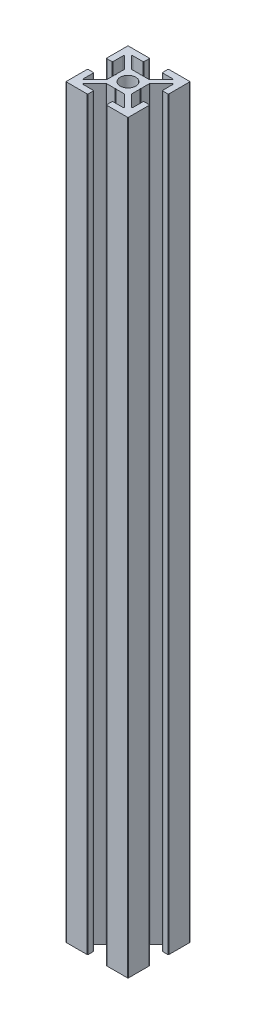
from build123d import *

# Parameters (mm, degrees)
SKETCH1_R           = 2.5
BOSS_EXTRUDE1_DEPTH = 240


with BuildPart() as part:
    # Sketch1 → Boss-Extrude1 (new body)
    with BuildSketch(Plane(origin=(0, 0, 0), x_dir=(1, 0, 0), z_dir=(0, 1, 0))):
        with BuildLine():
            Line((-2.997918472, 4.058578644), (-6.597918472, 7.658578644))
            ThreePointArc((-6.597918472, 7.658578644), (-6.621415508, 7.686854412), (-6.639339828, 7.718953455))
            ThreePointArc((-6.639339828, 7.718953455), (-6.656497116, 7.8), (-6.639339828, 7.881046545))
            ThreePointArc((-6.639339828, 7.881046545), (-6.565562901, 7.967644429), (-6.456497116, 8))
            Line((-6.456497116, 8), (-3.2, 8))
            ThreePointArc((-3.2, 8), (-3.058578644, 8.058578644), (-3, 8.2))
            Line((-3, 8.2), (-3, 9.8))
            ThreePointArc((-3, 9.8), (-3.058578644, 9.941421356), (-3.2, 10))
            Line((-3.2, 10), (-9.8, 10))
            ThreePointArc((-9.8, 10), (-9.941421356, 9.941421356), (-10, 9.8))
            Line((-10, 9.8), (-10, 3.2))
            ThreePointArc((-10, 3.2), (-9.941421356, 3.058578644), (-9.8, 3))
            Line((-9.8, 3), (-8.2, 3))
            ThreePointArc((-8.2, 3), (-8.058578644, 3.058578644), (-8, 3.2))
            Line((-8, 3.2), (-8, 6.456497116))
            ThreePointArc((-8, 6.456497116), (-7.967644429, 6.565562901), (-7.881046545, 6.639339828))
            ThreePointArc((-7.881046545, 6.639339828), (-7.8, 6.656497116), (-7.718953455, 6.639339828))
            ThreePointArc((-7.718953455, 6.639339828), (-7.686854412, 6.621415508), (-7.658578644, 6.597918472))
            Line((-7.658578644, 6.597918472), (-4.058578644, 2.997918472))
            ThreePointArc((-4.058578644, 2.997918472), (-4.015224093, 2.933033802), (-4, 2.856497116))
            Line((-4, 2.856497116), (-4, 0.130901699))
            ThreePointArc((-4, 0.130901699), (-3.99253254, 0.104615144), (-3.97236068, 0.08618034))
            Line((-3.97236068, 0.08618034), (-3.8, 0))
            Line((-3.8, 0), (-3.97236068, -0.08618034))
            ThreePointArc((-3.97236068, -0.08618034), (-3.99253254, -0.104615144), (-4, -0.130901699))
            Line((-4, -0.130901699), (-4, -2.856497116))
            ThreePointArc((-4, -2.856497116), (-4.015224093, -2.933033802), (-4.058578644, -2.997918472))
            Line((-4.058578644, -2.997918472), (-7.658578644, -6.597918472))
            ThreePointArc((-7.658578644, -6.597918472), (-7.686854412, -6.621415508), (-7.718953455, -6.639339828))
            ThreePointArc((-7.718953455, -6.639339828), (-7.8, -6.656497116), (-7.881046545, -6.639339828))
            ThreePointArc((-7.881046545, -6.639339828), (-7.967644429, -6.565562901), (-8, -6.456497116))
            Line((-8, -6.456497116), (-8, -3.2))
            ThreePointArc((-8, -3.2), (-8.058578644, -3.058578644), (-8.2, -3))
            Line((-8.2, -3), (-9.8, -3))
            ThreePointArc((-9.8, -3), (-9.941421356, -3.058578644), (-10, -3.2))
            Line((-10, -3.2), (-10, -9.8))
            ThreePointArc((-10, -9.8), (-9.941421356, -9.941421356), (-9.8, -10))
            Line((-9.8, -10), (-3.2, -10))
            ThreePointArc((-3.2, -10), (-3.058578644, -9.941421356), (-3, -9.8))
            Line((-3, -9.8), (-3, -8.2))
            ThreePointArc((-3, -8.2), (-3.058578644, -8.058578644), (-3.2, -8))
            Line((-3.2, -8), (-6.456497116, -8))
            ThreePointArc((-6.456497116, -8), (-6.565562901, -7.967644429), (-6.639339828, -7.881046545))
            ThreePointArc((-6.639339828, -7.881046545), (-6.656497116, -7.8), (-6.639339828, -7.718953455))
            ThreePointArc((-6.639339828, -7.718953455), (-6.621415508, -7.686854412), (-6.597918472, -7.658578644))
            Line((-6.597918472, -7.658578644), (-2.997918472, -4.058578644))
            ThreePointArc((-2.997918472, -4.058578644), (-2.933033802, -4.015224093), (-2.856497116, -4))
            Line((-2.856497116, -4), (-0.211803399, -4))
            ThreePointArc((-0.211803399, -4), (-0.200315753, -3.998662449), (-0.189442719, -3.99472136))
            Line((-0.189442719, -3.99472136), (0, -3.9))
            Line((0, -3.9), (0.189442719, -3.99472136))
            ThreePointArc((0.189442719, -3.99472136), (0.200315753, -3.998662449), (0.211803399, -4))
            Line((0.211803399, -4), (2.856497116, -4))
            ThreePointArc((2.856497116, -4), (2.933033802, -4.015224093), (2.997918472, -4.058578644))
            Line((2.997918472, -4.058578644), (6.597918472, -7.658578644))
            ThreePointArc((6.597918472, -7.658578644), (6.621415508, -7.686854412), (6.639339828, -7.718953455))
            ThreePointArc((6.639339828, -7.718953455), (6.656497116, -7.8), (6.639339828, -7.881046545))
            ThreePointArc((6.639339828, -7.881046545), (6.565562901, -7.967644429), (6.456497116, -8))
            Line((6.456497116, -8), (3.2, -8))
            ThreePointArc((3.2, -8), (3.058578644, -8.058578644), (3, -8.2))
            Line((3, -8.2), (3, -9.8))
            ThreePointArc((3, -9.8), (3.058578644, -9.941421356), (3.2, -10))
            Line((3.2, -10), (9.8, -10))
            ThreePointArc((9.8, -10), (9.941421356, -9.941421356), (10, -9.8))
            Line((10, -9.8), (10, -3.2))
            ThreePointArc((10, -3.2), (9.941421356, -3.058578644), (9.8, -3))
            Line((9.8, -3), (8.2, -3))
            ThreePointArc((8.2, -3), (8.058578644, -3.058578644), (8, -3.2))
            Line((8, -3.2), (8, -6.456497116))
            ThreePointArc((8, -6.456497116), (7.967644429, -6.565562901), (7.881046545, -6.639339828))
            ThreePointArc((7.881046545, -6.639339828), (7.8, -6.656497116), (7.718953455, -6.639339828))
            ThreePointArc((7.718953455, -6.639339828), (7.686854412, -6.621415508), (7.658578644, -6.597918472))
            Line((7.658578644, -6.597918472), (4.058578644, -2.997918472))
            ThreePointArc((4.058578644, -2.997918472), (4.015224093, -2.933033802), (4, -2.856497116))
            Line((4, -2.856497116), (4, -0.130901699))
            ThreePointArc((4, -0.130901699), (3.99253254, -0.104615144), (3.97236068, -0.08618034))
            Line((3.97236068, -0.08618034), (3.8, 0))
            Line((3.8, 0), (3.97236068, 0.08618034))
            ThreePointArc((3.97236068, 0.08618034), (3.99253254, 0.104615144), (4, 0.130901699))
            Line((4, 0.130901699), (4, 2.856497116))
            ThreePointArc((4, 2.856497116), (4.015224093, 2.933033802), (4.058578644, 2.997918472))
            Line((4.058578644, 2.997918472), (7.658578644, 6.597918472))
            ThreePointArc((7.658578644, 6.597918472), (7.686854412, 6.621415508), (7.718953455, 6.639339828))
            ThreePointArc((7.718953455, 6.639339828), (7.8, 6.656497116), (7.881046545, 6.639339828))
            ThreePointArc((7.881046545, 6.639339828), (7.967644429, 6.565562901), (8, 6.456497116))
            Line((8, 6.456497116), (8, 3.2))
            ThreePointArc((8, 3.2), (8.058578644, 3.058578644), (8.2, 3))
            Line((8.2, 3), (9.8, 3))
            ThreePointArc((9.8, 3), (9.941421356, 3.058578644), (10, 3.2))
            Line((10, 3.2), (10, 9.8))
            ThreePointArc((10, 9.8), (9.941421356, 9.941421356), (9.8, 10))
            Line((9.8, 10), (3.2, 10))
            ThreePointArc((3.2, 10), (3.058578644, 9.941421356), (3, 9.8))
            Line((3, 9.8), (3, 8.2))
            ThreePointArc((3, 8.2), (3.058578644, 8.058578644), (3.2, 8))
            Line((3.2, 8), (6.456497116, 8))
            ThreePointArc((6.456497116, 8), (6.565562901, 7.967644429), (6.639339828, 7.881046545))
            ThreePointArc((6.639339828, 7.881046545), (6.656497116, 7.8), (6.639339828, 7.718953455))
            ThreePointArc((6.639339828, 7.718953455), (6.621415508, 7.686854412), (6.597918472, 7.658578644))
            Line((6.597918472, 7.658578644), (2.997918472, 4.058578644))
            ThreePointArc((2.997918472, 4.058578644), (2.933033802, 4.015224093), (2.856497116, 4))
            Line((2.856497116, 4), (0.211803399, 4))
            ThreePointArc((0.211803399, 4), (0.200315753, 3.998662449), (0.189442719, 3.99472136))
            Line((0.189442719, 3.99472136), (0, 3.9))
            Line((0, 3.9), (-0.189442719, 3.99472136))
            ThreePointArc((-0.189442719, 3.99472136), (-0.200315753, 3.998662449), (-0.211803399, 4))
            Line((-0.211803399, 4), (-2.856497116, 4))
            ThreePointArc((-2.856497116, 4), (-2.933033802, 4.015224093), (-2.997918472, 4.058578644))
        make_face()
        Circle(SKETCH1_R, mode=Mode.SUBTRACT)
    extrude(amount=BOSS_EXTRUDE1_DEPTH)


solid = part.part
